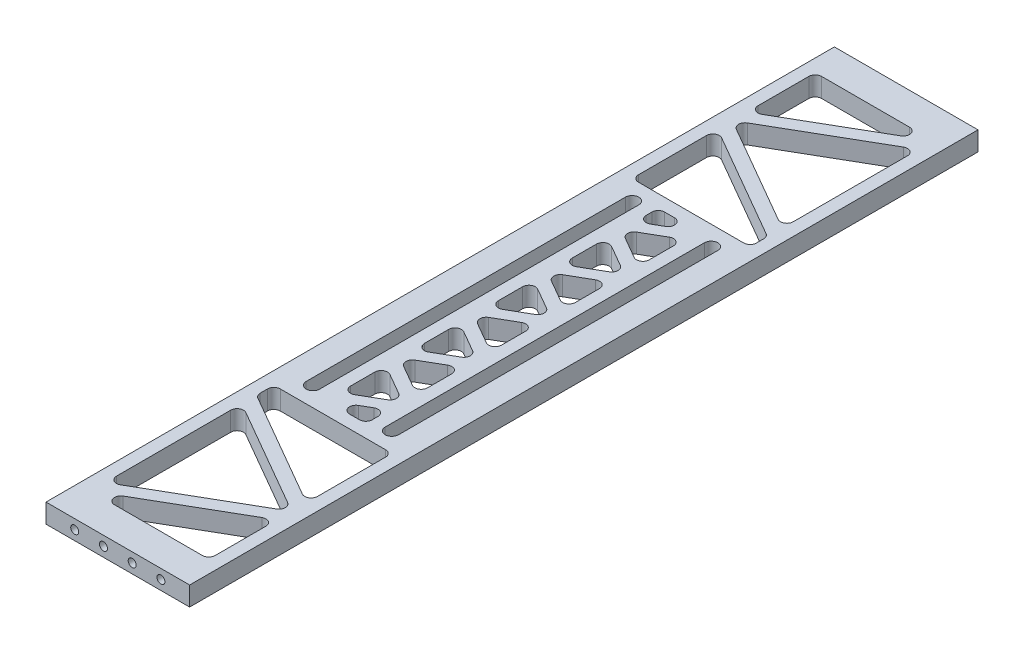
from build123d import *

# Parameters (mm, degrees)
SKETCH_1_W          = 45
SKETCH_1_H          = 247
EXTRUDE_1_DEPTH     = 6
CUT_EXTRUDE_1_DEPTH = 249.095243808
CUT_EXTRUDE_2_DEPTH = 249.095243808
FILLET_1_R          = 2
M3X0_52_D           = 2.5
M3X0_52_DEPTH       = 8.5
M3X0_52_TIP         = 0.751075774
M3X0_51_D           = 2.5
M3X0_51_DEPTH       = 8.5
M3X0_51_TIP         = 0.751075774


with BuildPart() as part:
    # Эскиз1 → Бобышка-Вытянуть1 (new body)
    with BuildSketch(Plane(origin=(0, 0, 0), x_dir=(1, 0, 0), z_dir=(0, 1, 0))):
        with Locations((0, -123.5)):
            Rectangle(SKETCH_1_W, SKETCH_1_H)
    extrude(amount=EXTRUDE_1_DEPTH)

    # Эскиз2 → Вырез-Вытянуть1 (cut, through all)
    with BuildSketch(Plane(origin=(0, 6, 0), x_dir=(1, 0, 0), z_dir=(0, 1, 0))):
        with BuildLine():
            Line((-10.274368671, -73.5), (-10.274368671, -173.5))
            ThreePointArc((-10.274368671, -173.5), (-12.374368671, -175.6), (-14.474368671, -173.5))
            Line((-14.474368671, -173.5), (-14.474368671, -73.5))
            ThreePointArc((-14.474368671, -73.5), (-12.374368671, -71.4), (-10.274368671, -73.5))
        make_face()
        with BuildLine():
            Line((10.274368671, -73.5), (10.274368671, -173.5))
            ThreePointArc((10.274368671, -173.5), (12.374368671, -175.6), (14.474368671, -173.5))
            Line((14.474368671, -173.5), (14.474368671, -73.5))
            ThreePointArc((14.474368671, -73.5), (12.374368671, -71.4), (10.274368671, -73.5))
        make_face()
    extrude(amount=-CUT_EXTRUDE_1_DEPTH, mode=Mode.SUBTRACT)

    # Эскиз14 → Вырез-Вытянуть2 (cut, through all)
    with BuildSketch(Plane(origin=(0, 6, 0), x_dir=(1, 0, 0), z_dir=(0, 1, 0))):
        Polygon((-18.5, -10), (18.5, -10), (-18.5, -31.36195996), align=None)
        Polygon((-18.5, -35.980762114), (18.5, -14.618802154), (18.5, -57.342722074), align=None)
        Polygon((-18.5, -40.599564267), (-18.5, -67.4), (18.5, -67.4), (18.5, -61.961524227), align=None)
        Polygon((6.274368671, -71.4), (-6.274368671, -78.645016882), (-6.274368671, -71.4), align=None)
        Polygon((6.274368671, -75.730127019), (-6.274368671, -82.975143901), (6.274368671, -90.220160783), align=None)
        Polygon((-6.274368671, -87.30527092), (6.274368671, -94.550287802), (-6.274368671, -101.795304684), align=None)
        Polygon((-6.274368671, -106.125431703), (6.274368671, -98.880414821), (6.274368671, -113.370448585), align=None)
        Polygon((-6.274368671, -110.455558722), (6.274368671, -117.700575604), (-6.274368671, -124.945592486), align=None)
        Polygon((-6.274368671, -129.275719505), (6.274368671, -122.030702623), (6.274368671, -136.520736387), align=None)
        Polygon((-6.274368671, -133.605846524), (6.274368671, -140.850863406), (-6.274368671, -148.095880288), align=None)
        Polygon((-6.274368671, -152.426007307), (6.274368671, -145.180990425), (6.274368671, -159.671024189), align=None)
        Polygon((-6.274368671, -156.756134326), (6.274368671, -164.001151208), (-6.274368671, -171.24616809), align=None)
        Polygon((-6.274368671, -175.576295109), (6.274368671, -168.331278227), (6.274368671, -175.576295109), align=None)
        Polygon((-18.5, -179.6), (-18.5, -185.038475773), (18.5, -206.400435733), (18.5, -179.6), align=None)
        Polygon((-18.5, -232.381197846), (-18.5, -189.657277926), (18.5, -211.019237886), align=None)
        Polygon((18.5, -215.63804004), (18.5, -237), (-18.5, -237), align=None)
    extrude(amount=-CUT_EXTRUDE_2_DEPTH, mode=Mode.SUBTRACT)

    # Скругление1
    fillet_1_edges = [part.edges().sort_by_distance(p)[0] for p in [
        (-6.274368671, 3, 101.795304684),
        (-6.274368671, 3, 87.30527092),
        (6.274368671, 3, 94.550287802),
        (6.274368671, 3, 113.370448585),
        (-6.274368671, 3, 106.125431703),
        (6.274368671, 3, 98.880414821),
        (-6.274368671, 3, 124.945592486),
        (-6.274368671, 3, 110.455558722),
        (6.274368671, 3, 117.700575604),
        (6.274368671, 3, 136.520736387),
        (-6.274368671, 3, 129.275719505),
        (6.274368671, 3, 122.030702623),
        (-6.274368671, 3, 148.095880288),
        (-6.274368671, 3, 133.605846524),
        (6.274368671, 3, 140.850863406),
        (6.274368671, 3, 159.671024189),
        (-6.274368671, 3, 152.426007307),
        (6.274368671, 3, 145.180990425),
        (-6.274368671, 3, 171.24616809),
        (-6.274368671, 3, 156.756134326),
        (6.274368671, 3, 164.001151208),
        (6.274368671, 3, 175.576295109),
        (-6.274368671, 3, 175.576295109),
        (6.274368671, 3, 168.331278227),
        (-18.5, 3, 179.6),
        (18.5, 3, 179.6),
        (18.5, 3, 206.400435733),
        (-18.5, 3, 185.038475773),
        (18.5, 3, 211.019237886),
        (-18.5, 3, 232.381197846),
        (-18.5, 3, 189.657277926),
        (-18.5, 3, 237),
        (18.5, 3, 215.63804004),
        (18.5, 3, 237),
        (-18.5, 3, 31.36195996),
        (-18.5, 3, 10),
        (18.5, 3, 10),
        (18.5, 3, 57.342722074),
        (-18.5, 3, 35.980762114),
        (18.5, 3, 14.618802154),
        (-18.5, 3, 40.599564267),
        (18.5, 3, 61.961524227),
        (18.5, 3, 67.4),
        (-18.5, 3, 67.4),
        (-6.274368671, 3, 71.4),
        (6.274368671, 3, 71.4),
        (-6.274368671, 3, 78.645016882),
        (6.274368671, 3, 75.730127019),
        (6.274368671, 3, 90.220160783),
        (-6.274368671, 3, 82.975143901),
    ]]
    fillet(fillet_1_edges, radius=FILLET_1_R)

    # Отверстие обработанное метчиком M3x0.52
    with Locations(Plane(origin=(0, 0, 0), x_dir=(-1, 0, 0), z_dir=(0, 0, -1))):
        with Locations((-13.5, 3), (-4.5, 3), (4.5, 3), (13.5, 3)):
            Hole(M3X0_52_D / 2, depth=M3X0_52_DEPTH)
            with Locations((0, 0, -(M3X0_52_DEPTH + M3X0_52_TIP / 2))):  # 118° drill point
                Cone(0, M3X0_52_D / 2, M3X0_52_TIP, mode=Mode.SUBTRACT)

    # Отверстие обработанное метчиком M3x0.51
    with Locations(Plane.XY.offset(247)):
        with Locations((-13.5, 3), (-4.5, 3), (4.5, 3), (13.5, 3)):
            Hole(M3X0_51_D / 2, depth=M3X0_51_DEPTH)
            with Locations((0, 0, -(M3X0_51_DEPTH + M3X0_51_TIP / 2))):  # 118° drill point
                Cone(0, M3X0_51_D / 2, M3X0_51_TIP, mode=Mode.SUBTRACT)


solid = part.part
